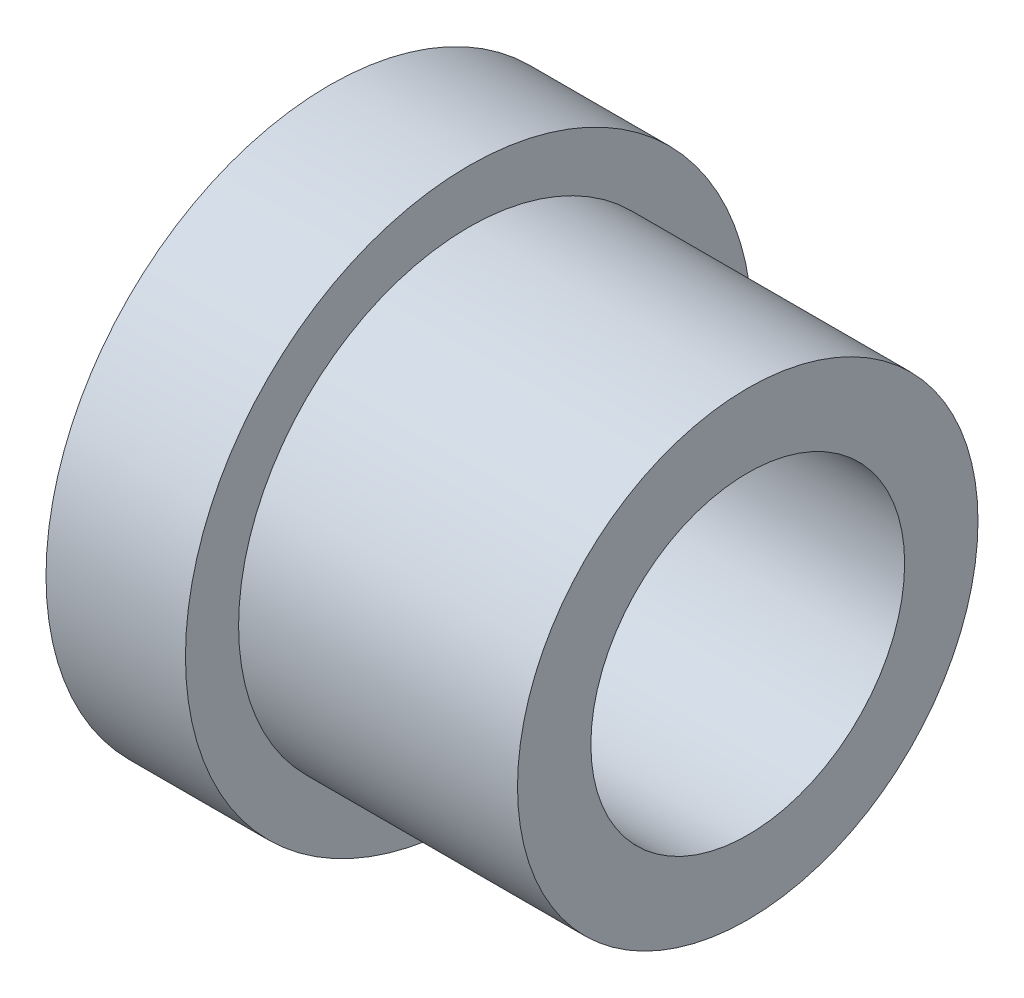
from build123d import *


with BuildPart() as part:
    # Sketch1 → Revolve1 (revolve)
    with BuildSketch(Plane(origin=(0, 0, 0), x_dir=(1, 0, 0), z_dir=(0, 1, 0)), mode=Mode.PRIVATE) as revolve1_sk:
        Polygon((0, 11.25), (0, 20.32), (10, 20.32), (10, 16.51), (30, 16.51), (30, 11.25), (12.5, 11.25), (12.5, 4.5), (9.5, 4.5), (9.5, 8.5), (6.5, 8.5), (6.5, 11.25), align=None)
    revolve(revolve1_sk.sketch.rotate(Axis((0, 0, 0), (1, 0, 0)), 180), axis=Axis((0, 0, 0), (1, 0, 0)))


solid = part.part
